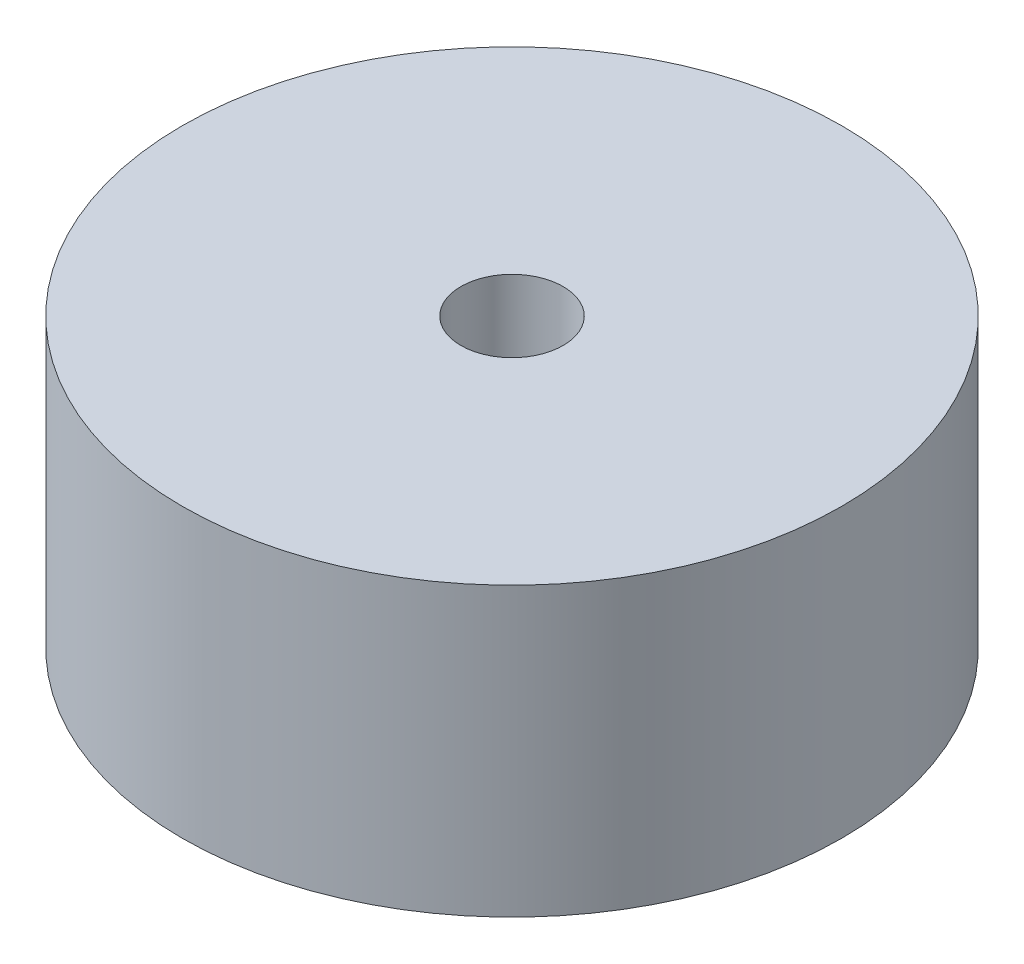
from build123d import *

# Parameters (mm, degrees)
SKETCH_1_R          = 57.34
EXTRUDE_2_DEPTH     = 50
SKETCH_3_R          = 8.89
CUT_EXTRUDE_1_DEPTH = 50


with BuildPart() as part:
    # 草图1 → 凸台-拉伸2 (new body)
    with BuildSketch(Plane(origin=(0, 0, 0), x_dir=(1, 0, 0), z_dir=(0, 1, 0))):
        with Locations(Location((0, 0, 0), (0, 0, 270))):
            Circle(SKETCH_1_R)
    extrude(amount=EXTRUDE_2_DEPTH)

    # 草图3 → 切除-拉伸1 (cut)
    with BuildSketch(Plane(origin=(0, 50, 0), x_dir=(1, 0, 0), z_dir=(0, 1, 0))):
        with Locations(Location((0, 0, 0), (0, 0, 270))):
            Circle(SKETCH_3_R)
    extrude(amount=-CUT_EXTRUDE_1_DEPTH, mode=Mode.SUBTRACT)


solid = part.part
